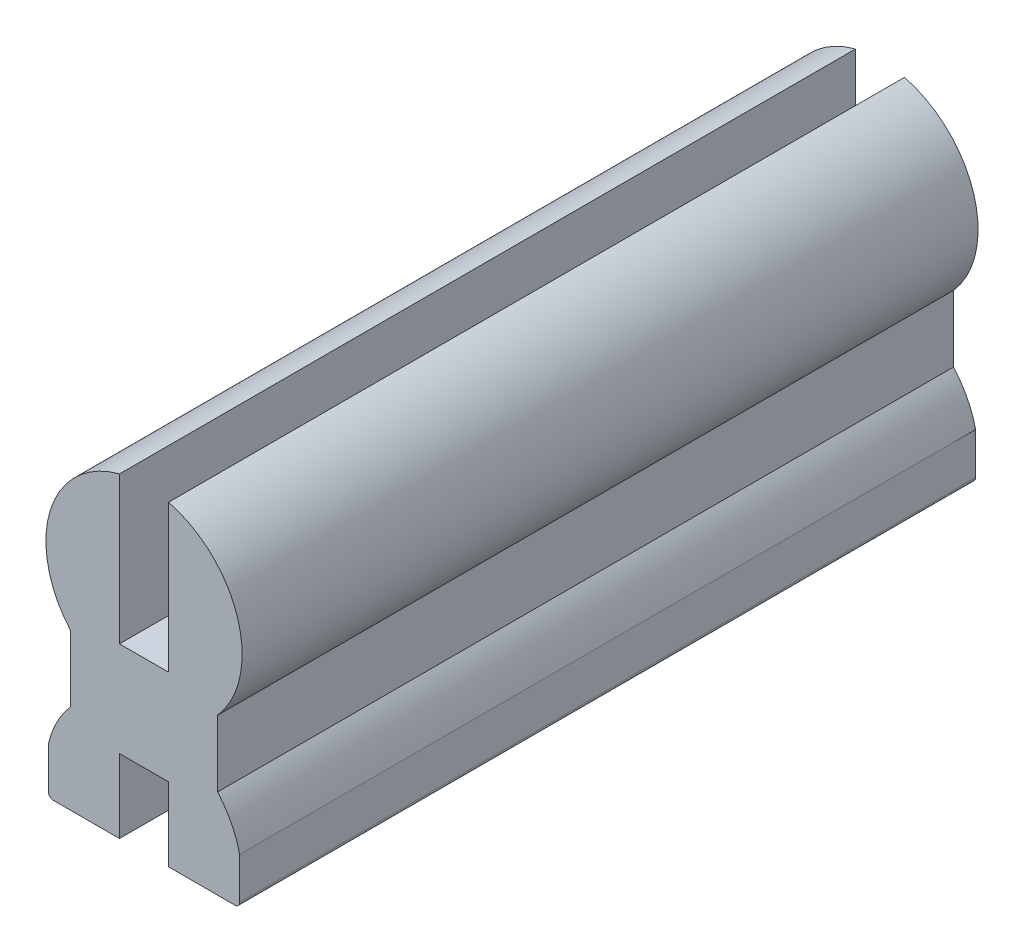
from build123d import *

# Parameters (mm, degrees)
EXTRUDE_1_DEPTH = 15
FILLET_1_R      = 0.1


with BuildPart() as part:
    # 草图1 → 凸台-拉伸1 (new body)
    with BuildSketch(Plane.XY):
        with BuildLine():
            Line((-1.95, -2.5), (-0.5, -2.5))
            Line((-0.5, -2.5), (-0.5, -1))
            Line((-0.5, -1), (0.5, -1))
            Line((0.5, -1), (0.5, -2.5))
            Line((0.5, -2.5), (1.95, -2.5))
            Line((1.95, -2.5), (1.95, -1.555590279))
            ThreePointArc((1.95, -1.555590279), (1.780042303, -1.088161527), (1.5, -0.677124344))
            Line((1.5, -0.677124344), (1.5, 0.677124344))
            ThreePointArc((1.5, 0.677124344), (1.912032648, 2.586626929), (0.5, 3.936491673))
            Line((0.5, 3.936491673), (0.5, 0.936491673))
            Line((0.5, 0.936491673), (-0.5, 0.936491673))
            Line((-0.5, 0.936491673), (-0.5, 3.936491673))
            ThreePointArc((-0.5, 3.936491673), (-1.912032648, 2.586626929), (-1.5, 0.677124344))
            Line((-1.5, 0.677124344), (-1.5, -0.677124344))
            ThreePointArc((-1.5, -0.677124344), (-1.780042303, -1.088161527), (-1.95, -1.555590279))
            Line((-1.95, -1.555590279), (-1.95, -2.5))
        make_face()
    extrude(amount=-EXTRUDE_1_DEPTH)

    # 圆角1
    fillet_1_edges = [part.edges().sort_by_distance(p)[0] for p in [
        (1.95, -2.5, -7.5),
        (-1.95, -2.5, -7.5),
    ]]
    fillet(fillet_1_edges, radius=FILLET_1_R)


solid = part.part
